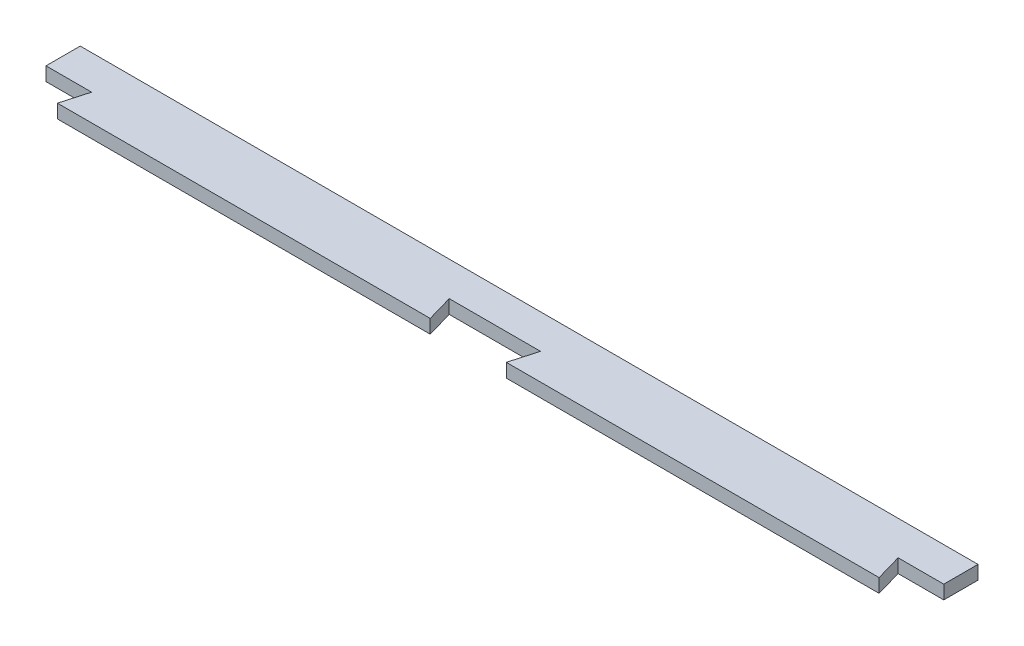
from build123d import *

# Parameters (mm, degrees)
SKETCH1_W           = 590
SKETCH1_H           = 5
BOSS_EXTRUDE1_DEPTH = 9


with BuildPart() as part:
    # Sketch1 → Boss-Extrude1 (new body)
    with BuildSketch(Plane(origin=(0, 0, 0), x_dir=(1, 0, 0), z_dir=(0, 1, 0))):
        Polygon((0, 35), (0, 17.5), (30, 17.5), (25, 0), (270, 0), (265, 17.5), (295, 17.5), (295, 35), align=None)
        Polygon((590, 35), (295, 35), (295, 17.5), (325, 17.5), (320, 0), (565, 0), (560, 17.5), (590, 17.5), align=None)
        with Locations((295, 37.5)):
            Rectangle(SKETCH1_W, SKETCH1_H)
    extrude(amount=BOSS_EXTRUDE1_DEPTH)


solid = part.part
